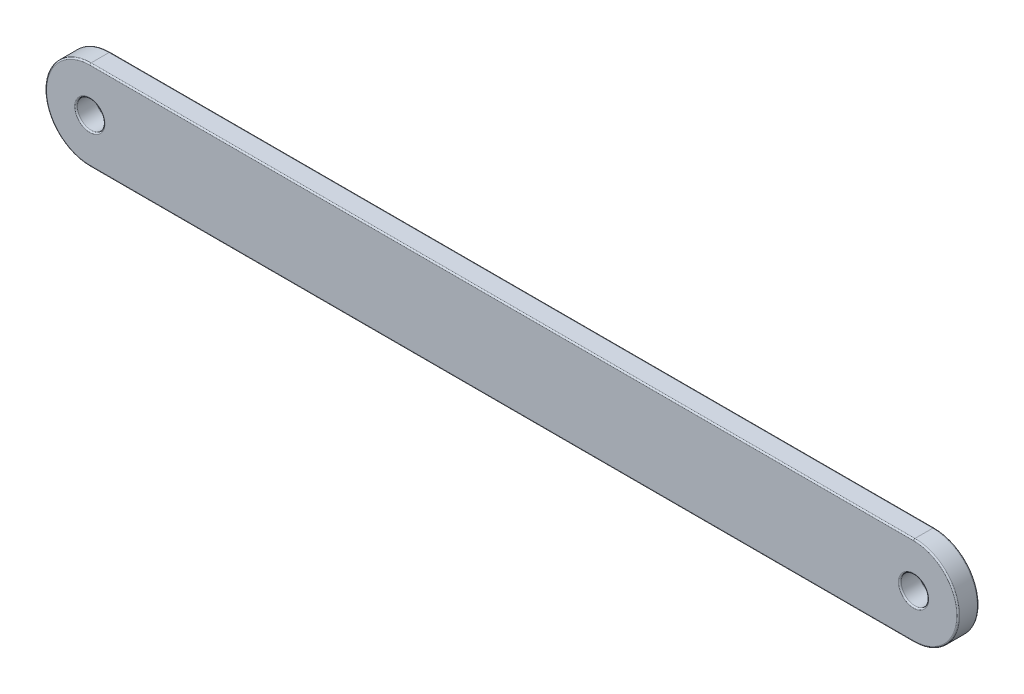
from build123d import *

# Parameters (mm, degrees)
CROQUIS1_R              = 1
SALIENTE_EXTRUIR1_DEPTH = 1.5
REDONDEO1_R             = 0.1


with BuildPart() as part:
    # Croquis1 → Saliente-Extruir1 (new body)
    with BuildSketch(Plane.XY):
        with BuildLine():
            Line((-30, 3.25), (30, 3.25))
            ThreePointArc((30, 3.25), (33.25, 0), (30, -3.25))
            Line((30, -3.25), (-30, -3.25))
            ThreePointArc((-30, -3.25), (-33.25, 0), (-30, 3.25))
        make_face()
        with Locations((-30, 0)):
            Circle(CROQUIS1_R, mode=Mode.SUBTRACT)
        with Locations((30, 0)):
            Circle(CROQUIS1_R, mode=Mode.SUBTRACT)
    extrude(amount=SALIENTE_EXTRUIR1_DEPTH)

    # Redondeo1
    redondeo1_edges = [part.edges().sort_by_distance(p)[0] for p in [
        (-31, 0, 0),
        (-31, 0, 1.5),
        (33.25, 0, 1.5),
        (29, 0, 0),
        (29, 0, 1.5),
        (0, 3.25, 1.5),
        (-33.25, 0, 1.5),
        (0, 3.25, 0),
        (33.25, 0, 0),
        (0, -3.25, 0),
        (-33.25, 0, 0),
        (0, -3.25, 1.5),
    ]]
    fillet(redondeo1_edges, radius=REDONDEO1_R)


solid = part.part
